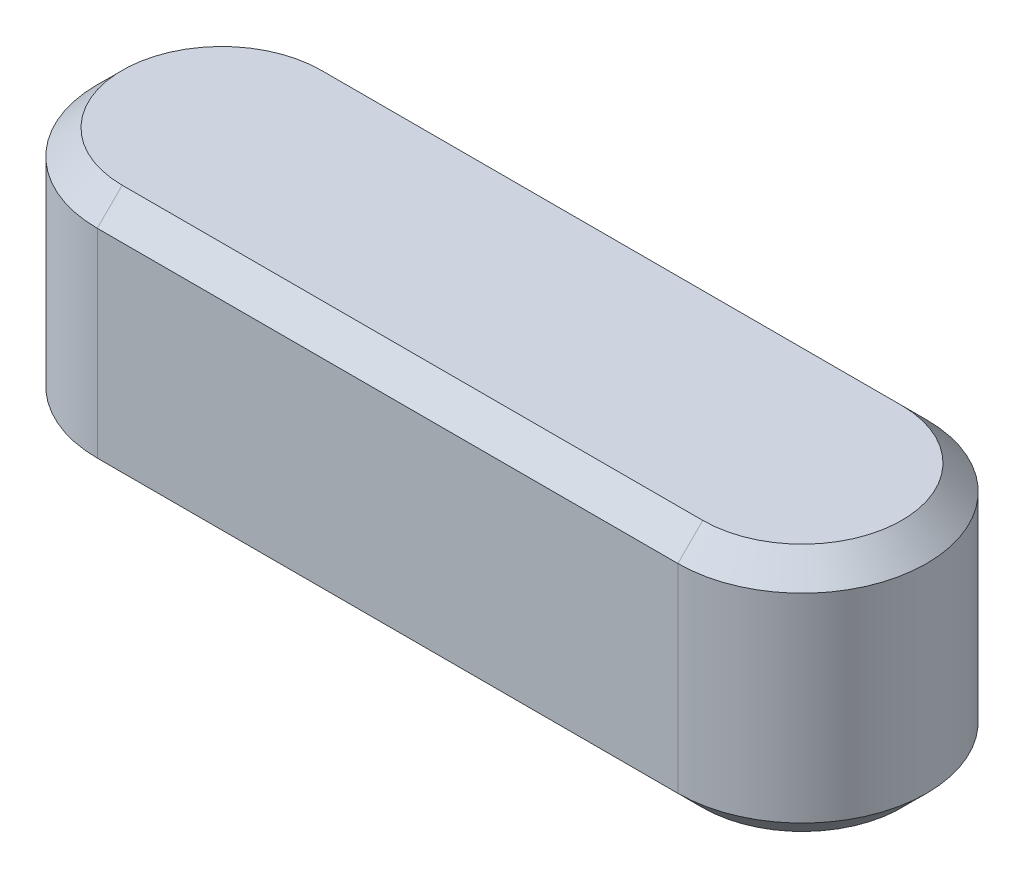
from build123d import *

# Parameters (mm, degrees)
EXTRUDE_1_DEPTH = 3
CHAMFER_1_SIZE  = 0.3


with BuildPart() as part:
    # 草图1 → 凸台-拉伸1 (new body)
    with BuildSketch(Plane(origin=(0, 0, 0), x_dir=(1, 0, 0), z_dir=(0, 1, 0))):
        with BuildLine():
            Line((-3.5, 1.5), (3.5, 1.5))
            ThreePointArc((3.5, 1.5), (5, 0), (3.5, -1.5))
            Line((3.5, -1.5), (-3.5, -1.5))
            ThreePointArc((-3.5, -1.5), (-5, 0), (-3.5, 1.5))
        make_face()
    extrude(amount=EXTRUDE_1_DEPTH)

    # 倒角1
    chamfer_1_edges = [part.edges().sort_by_distance(p)[0] for p in [
        (5, 3, 0),
        (0, 3, -1.5),
        (-5, 3, 0),
        (0, 0, -1.5),
        (5, 0, 0),
        (0, 0, 1.5),
        (-5, 0, 0),
        (0, 3, 1.5),
    ]]
    chamfer(chamfer_1_edges, length=CHAMFER_1_SIZE)


solid = part.part
